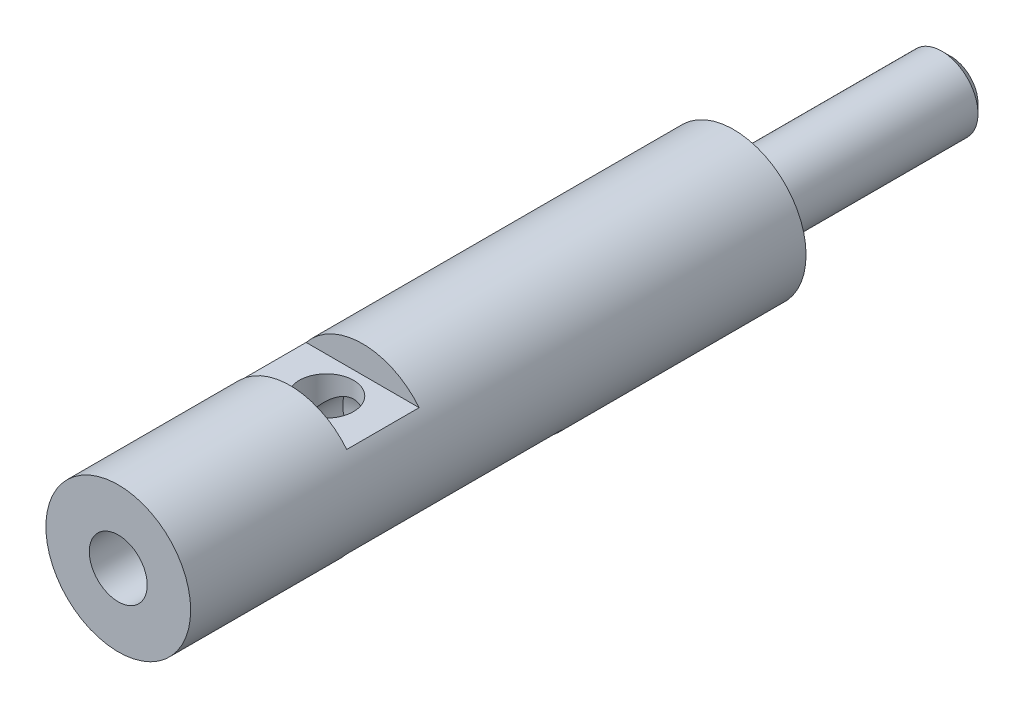
from build123d import *

# Parameters (mm, degrees)
SKETCH1_R                      = 4
BOSS_EXTRUDE1_DEPTH            = 34
SKETCH2_R                      = 2
BOSS_EXTRUDE2_DEPTH            = 12
CHAMFER1_SIZE                  = 0.5
F_3_2_3_2_DIAMETER_HOLE1_D     = 3.2
F_3_2_3_2_DIAMETER_HOLE1_DEPTH = 14
F_3_2_3_2_DIAMETER_HOLE1_TIP   = 0.96137699
CUT_EXTRUDE1_DEPTH             = 47.346520905
CUT_EXTRUDE1_DEPTH_BACK        = 47.346520905
SKETCH5_W                      = 12
SKETCH5_H                      = 1.5
SKETCH5_W_2                    = 4
F_3_0_3_DIAMETER_HOLE1_REACH   = 48.629
F_3_0_3_DIAMETER_HOLE1_BORE_R  = 1.5


with BuildPart() as part:
    # Sketch1 → Boss-Extrude1 (new body)
    with BuildSketch(Plane.XY):
        Circle(SKETCH1_R)
    extrude(amount=-BOSS_EXTRUDE1_DEPTH)

    # Sketch2 → Boss-Extrude2 (add)
    with BuildSketch(Plane(origin=(0, 0, -34), x_dir=(-1, 0, 0), z_dir=(0, 0, -1))):
        Circle(SKETCH2_R)
    extrude(amount=BOSS_EXTRUDE2_DEPTH)

    # Chamfer1
    chamfer1_edges = [part.edges().sort_by_distance(p)[0] for p in [
        (2, 0, -46),
    ]]
    chamfer(chamfer1_edges, length=CHAMFER1_SIZE)

    # Ø3.2 (3.2) Diameter Hole1
    with Locations(Plane.XY):
        with Locations((0, 0)):
            Hole(F_3_2_3_2_DIAMETER_HOLE1_D / 2, depth=F_3_2_3_2_DIAMETER_HOLE1_DEPTH)
            with Locations((0, 0, -(F_3_2_3_2_DIAMETER_HOLE1_DEPTH + F_3_2_3_2_DIAMETER_HOLE1_TIP / 2))):  # 118° drill point
                Cone(0, F_3_2_3_2_DIAMETER_HOLE1_D / 2, F_3_2_3_2_DIAMETER_HOLE1_TIP, mode=Mode.SUBTRACT)

    # Sketch5 → Cut-Extrude1 (cut, two sides: drawn at the far end of the back side and taken through both)
    with BuildSketch(Plane(origin=(0, 0, 0), x_dir=(0, 0, -1), z_dir=(1, 0, 0)).offset(-CUT_EXTRUDE1_DEPTH_BACK)):
        with Locations((15.5, -3.25)):
            Rectangle(SKETCH5_W, SKETCH5_H)
        with Locations((11.5, 3.25)):
            Rectangle(SKETCH5_W_2, SKETCH5_H)
    extrude(amount=CUT_EXTRUDE1_DEPTH + CUT_EXTRUDE1_DEPTH_BACK, mode=Mode.SUBTRACT)

    # Ø3.0 (3) Diameter Hole1 bore → Ø3.0 (3) Diameter Hole1 (cut, up to next)
    with BuildSketch(Plane(origin=(0, 2.5, 0), x_dir=(1, 0, 0), z_dir=(0, 1, 0)), mode=Mode.PRIVATE) as f_3_0_3_diameter_hole1_sk1:
        with Locations((0, 11.5)):
            Circle(F_3_0_3_DIAMETER_HOLE1_BORE_R)
    f_3_0_3_diameter_hole1_tool1 = extrude(f_3_0_3_diameter_hole1_sk1.sketch, amount=-F_3_0_3_DIAMETER_HOLE1_REACH, mode=Mode.PRIVATE) & part.part
    add(f_3_0_3_diameter_hole1_tool1.solids().sort_by_distance((0, 2.5, -11.5))[0], mode=Mode.SUBTRACT)


solid = part.part
